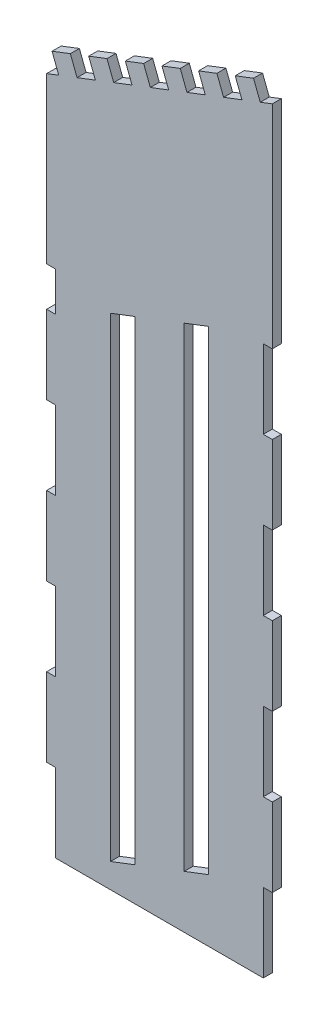
from build123d import *

# Parameters (mm, degrees)
BOSS_EXTRUDE1_DEPTH = 1.4605
SKETCH2_W           = 2.921
SKETCH2_H           = 25.4
SKETCH2_H_2         = 12.7
CUT_EXTRUDE1_DEPTH  = 2.921
SKETCH3_W           = 6.35
SKETCH3_H           = 2.921
BOSS_EXTRUDE2_DEPTH = 6.0452
CUT_EXTRUDE2_DEPTH  = 147.066332108


with BuildPart() as part:
    # Sketch1 → Boss-Extrude1 (new, symmetric)
    with BuildSketch(Plane.XY):
        Polygon((-36.517931963, 109.22), (36.517931963, 137.255841429), (36.517931963, -109.22), (-36.517931963, -109.22), align=None)
    extrude(amount=BOSS_EXTRUDE1_DEPTH, both=True)

    # Sketch2 → Cut-Extrude1 (cut)
    with BuildSketch(Plane.XY.offset(1.4605)):
        with Locations((-35.057431963, -96.52)):
            Rectangle(SKETCH2_W, SKETCH2_H)
        with Locations((-35.057431963, -45.72)):
            Rectangle(SKETCH2_W, SKETCH2_H)
        with Locations((-35.057431963, 5.08)):
            Rectangle(SKETCH2_W, SKETCH2_H)
        with Locations((-35.057431963, 49.53)):
            Rectangle(SKETCH2_W, SKETCH2_H_2)
        with Locations((35.057431963, 49.53)):
            Rectangle(SKETCH2_W, SKETCH2_H_2)
        with Locations((35.057431963, 5.08)):
            Rectangle(SKETCH2_W, SKETCH2_H)
        with Locations((35.057431963, -96.52)):
            Rectangle(SKETCH2_W, SKETCH2_H)
        with Locations((35.057431963, -45.72)):
            Rectangle(SKETCH2_W, SKETCH2_H)
        with Locations((35.057431963, 62.23)):
            Rectangle(SKETCH2_W, SKETCH2_H_2)
    extrude(amount=-CUT_EXTRUDE1_DEPTH, mode=Mode.SUBTRACT)

    # Sketch3 → Boss-Extrude2 (add)
    with BuildSketch(Plane(origin=(-41.231132307, 107.410771898, 0), x_dir=(0.9335804264972012, 0.35836794954530177, 0), z_dir=(-0.35836794954530177, 0.9335804264972012, 0))):
        with Locations((75.914520953, 0)):
            Rectangle(SKETCH3_W, SKETCH3_H)
        with Locations((63.214520953, 0)):
            Rectangle(SKETCH3_W, SKETCH3_H)
        with Locations((50.514520953, 0)):
            Rectangle(SKETCH3_W, SKETCH3_H)
        with Locations((37.814520953, 0)):
            Rectangle(SKETCH3_W, SKETCH3_H)
        with Locations((25.114520953, 0)):
            Rectangle(SKETCH3_W, SKETCH3_H)
        with Locations((12.414520953, 0)):
            Rectangle(SKETCH3_W, SKETCH3_H)
    extrude(amount=BOSS_EXTRUDE2_DEPTH)

    # Sketch5 → Cut-Extrude2 (cut, through all)
    with BuildSketch(Plane.XY.offset(1.4605)):
        Polygon((-15.875, 52.374079158), (-8.001, 55.39662457), (-8.001, -98.27337543), (-15.875, -101.295920842), align=None)
        Polygon((8.001, 61.539216859), (15.875, 64.561762271), (15.875, -89.108237729), (8.001, -92.130783141), align=None)
    extrude(amount=-CUT_EXTRUDE2_DEPTH, mode=Mode.SUBTRACT)


solid = part.part
